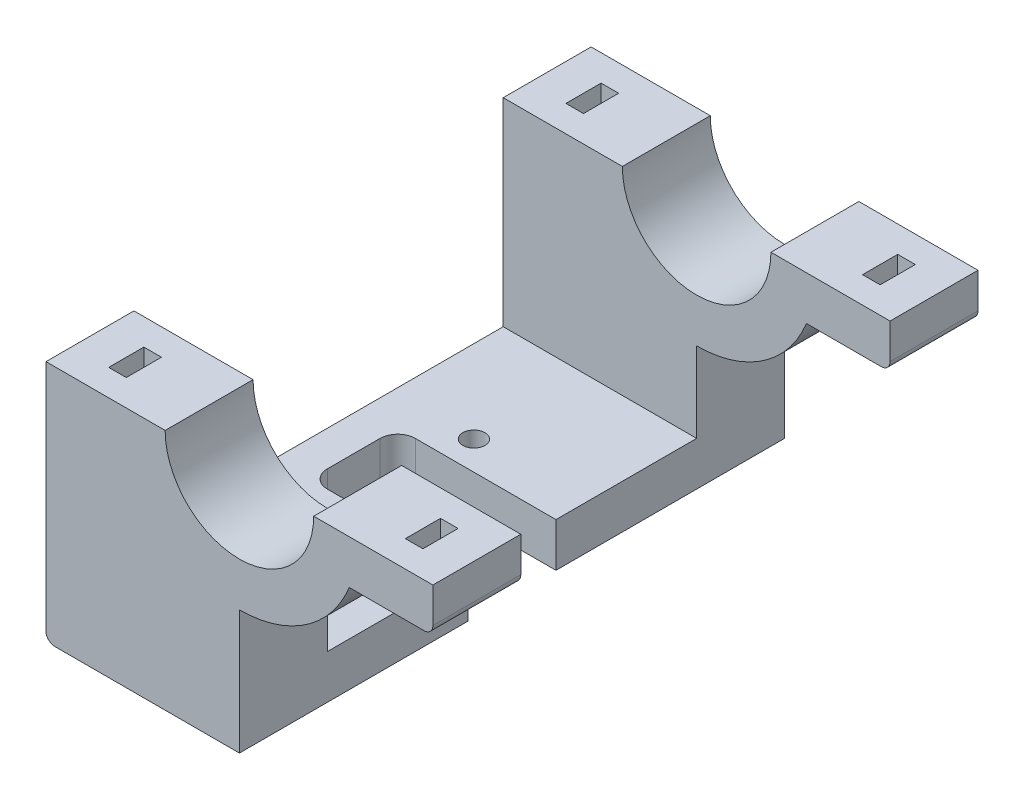
from build123d import *

# Parameters (mm, degrees)
BOSS_EXTRUDE1_DEPTH = 12.7
SKETCH3_W           = 2.54
SKETCH3_H           = 5.08
CUT_EXTRUDE1_DEPTH  = 47.550334048
SKETCH4_W           = 55.88
SKETCH4_H           = 6.35
BOSS_EXTRUDE2_DEPTH = 26.67
SKETCH5_R           = 1.6
SKETCH5_W           = 31.75
SKETCH5_H           = 12.699510518
CUT_EXTRUDE3_DEPTH  = 89.325838235
CUT_EXTRUDE4_REACH  = 92.585
FILLET1_R           = 1.27
FILLET2_R           = 2.54


with BuildPart() as part:
    # Sketch2 → Boss-Extrude1 (new body)
    with BuildSketch(Plane.XY):
        with BuildLine():
            Line((-27.94, 0), (-10.7315, 0))
            ThreePointArc((-10.7315, 0), (0, -10.7315), (10.7315, 0))
            Line((10.7315, 0), (27.94, 0))
            Line((27.94, 0), (27.94, -35))
            Line((27.94, -35), (-27.94, -35))
            Line((-27.94, -35), (-27.94, 0))
        make_face()
    extrude(amount=BOSS_EXTRUDE1_DEPTH)

    # Sketch3 → Cut-Extrude1 (cut, through all)
    with BuildSketch(Plane(origin=(0, 0, 0), x_dir=(1, 0, 0), z_dir=(0, 1, 0))):
        with Locations((-21.423122, -6.35)):
            Rectangle(SKETCH3_W, SKETCH3_H)
        with Locations((21.423122, -6.35)):
            Rectangle(SKETCH3_W, SKETCH3_H)
    extrude(amount=-CUT_EXTRUDE1_DEPTH, mode=Mode.SUBTRACT)

    # Sketch4 → Boss-Extrude2 (add)
    with BuildSketch(Plane.XY.offset(12.7)):
        with Locations((0, -31.825)):
            Rectangle(SKETCH4_W, SKETCH4_H)
    extrude(amount=BOSS_EXTRUDE2_DEPTH)

    # Mirror1: part across plane


with BuildPart() as part_1:
    add(part.part)
    add(part.part.mirror(Plane(origin=(0, 0, 39.37), x_dir=(1, 0, 0), z_dir=(0, 0, -1))))

    # Sketch5 → Cut-Extrude3 (cut, through all)
    with BuildSketch(Plane(origin=(0, -28.65, 0), x_dir=(1, 0, 0), z_dir=(0, 1, 0))):
        with Locations(Location((-16.002, -28.87, 0), (0, 0, 270))):
            Circle(SKETCH5_R)
        with Locations(Location((-16.002, -49.87, 0), (0, 0, 270))):
            Circle(SKETCH5_R)
        with Locations((-6.985, -39.369755259)):
            Rectangle(SKETCH5_W, SKETCH5_H)
    extrude(amount=-CUT_EXTRUDE3_DEPTH, mode=Mode.SUBTRACT)

    # Cut-Extrude4: up to this face of the body (flat: up to its plane)
    cut_extrude4_end = Plane(part_1.part.faces().sort_by_distance((0, -18.819419433, 0))[0])
    # Sketch7 → Cut-Extrude4 (cut, up to the picked face)
    with BuildSketch(Plane.XY.offset(78.74), mode=Mode.PRIVATE) as cut_extrude4_sk1:
        with BuildLine():
            Line((0, -17.0815), (0, -35))
            Line((0, -35), (27.94, -35))
            Line((27.94, -35), (27.94, -6.35))
            Line((27.94, -6.35), (15.857337174, -6.35))
            ThreePointArc((15.857337174, -6.35), (9.573664848, -14.146468945), (0, -17.0815))
        make_face()
    cut_extrude4_tool1 = split(extrude(cut_extrude4_sk1.sketch, amount=-CUT_EXTRUDE4_REACH, mode=Mode.PRIVATE), bisect_by=cut_extrude4_end, keep=Keep.BOTH, mode=Mode.PRIVATE)
    add(cut_extrude4_tool1.solids().sort_by(Axis((15.36412, -22.474959, 78.74), (0, 0, -1)))[0], mode=Mode.SUBTRACT)

    # Fillet1
    fillet1_edges = [part_1.edges().sort_by_distance(p)[0] for p in [
        (-27.94, -35, 39.37),
        (22.693122, -6.35, 6.35),
        (22.693122, -6.35, 72.39),
        (27.94, -6.35, 72.39),
        (27.94, -6.35, 6.35),
        (-22.693122, -35, 6.35),
        (-22.693122, -35, 72.39),
    ]]
    fillet(fillet1_edges, radius=FILLET1_R)

    # Fillet2
    fillet2_edges = [part_1.edges().sort_by_distance(p)[0] for p in [
        (-22.86, -31.825, 45.719510518),
        (-22.86, -31.825, 33.02),
    ]]
    fillet(fillet2_edges, radius=FILLET2_R)


solid = part_1.part
